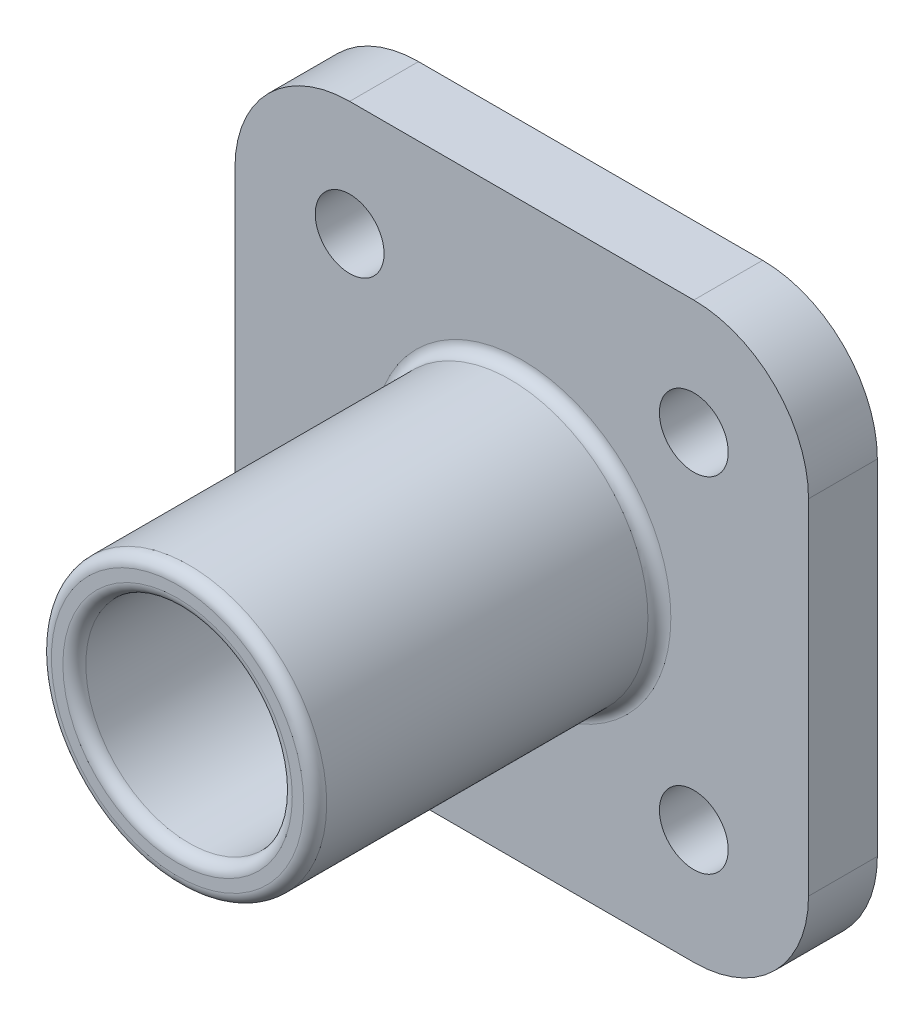
from build123d import *

# Parameters (mm, degrees)
ESQUISSE1_R        = 1.5
BOSS_EXTRU_1_DEPTH = 3
ESQUISSE2_R        = 6
ESQUISSE2_R_2      = 4.5
BOSS_EXTRU_2_DEPTH = 15
CONG_1_R           = 0.5


with BuildPart() as part:
    # Esquisse1 → Boss.-Extru.1 (new body)
    with BuildSketch(Plane.XY):
        with BuildLine():
            Line((7.5, -12.5), (-7.5, -12.5))
            ThreePointArc((-7.5, -12.5), (-11.035533906, -11.035533906), (-12.5, -7.5))
            Line((-12.5, -7.5), (-12.5, 7.5))
            ThreePointArc((-12.5, 7.5), (-11.035533906, 11.035533906), (-7.5, 12.5))
            Line((-7.5, 12.5), (7.5, 12.5))
            ThreePointArc((7.5, 12.5), (11.035533906, 11.035533906), (12.5, 7.5))
            Line((12.5, 7.5), (12.5, -7.5))
            ThreePointArc((12.5, -7.5), (11.035533906, -11.035533906), (7.5, -12.5))
        make_face()
        with Locations((-7.5, 7.5)):
            Circle(ESQUISSE1_R, mode=Mode.SUBTRACT)
        with Locations((7.5, 7.5)):
            Circle(ESQUISSE1_R, mode=Mode.SUBTRACT)
        with Locations((7.5, -7.5)):
            Circle(ESQUISSE1_R, mode=Mode.SUBTRACT)
        with Locations((-7.5, -7.5)):
            Circle(ESQUISSE1_R, mode=Mode.SUBTRACT)
    extrude(amount=BOSS_EXTRU_1_DEPTH)

    # Esquisse2 → Boss.-Extru.2 (add)
    with BuildSketch(Plane.XY.offset(3)):
        Circle(ESQUISSE2_R)
        Circle(ESQUISSE2_R_2, mode=Mode.SUBTRACT)
    extrude(amount=BOSS_EXTRU_2_DEPTH)

    # Congé1
    cong_1_edges = [part.edges().sort_by_distance(p)[0] for p in [
        (-6, 0, 18),
        (-6, 0, 3),
        (-4.5, 0, 18),
    ]]
    fillet(cong_1_edges, radius=CONG_1_R)


solid = part.part
